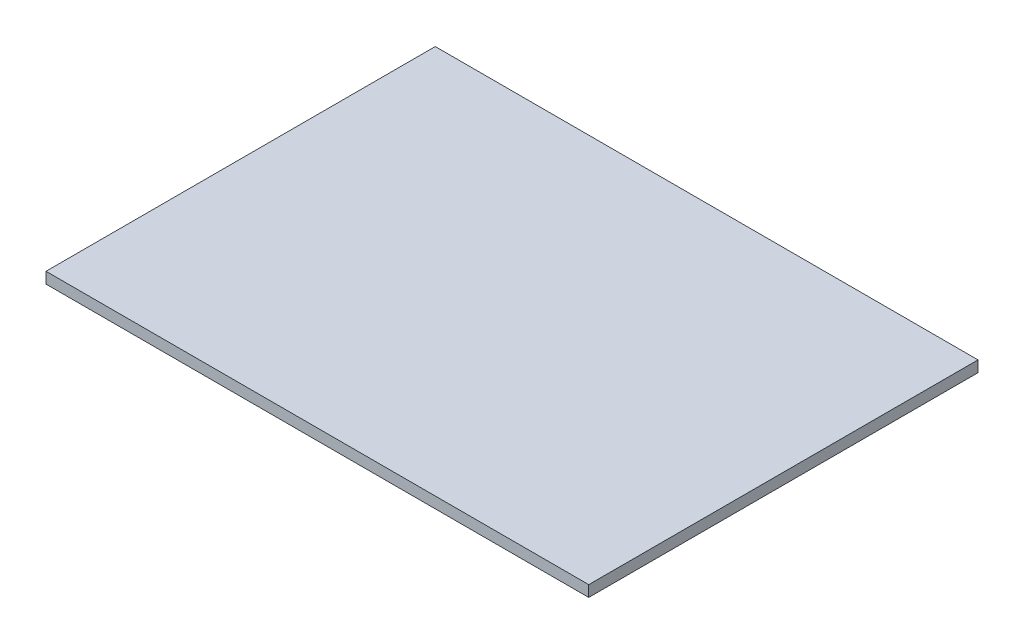
from build123d import *

# Parameters (mm, degrees)
SKETCH_1_W      = 244
SKETCH_1_H      = 175
EXTRUDE_1_DEPTH = 5


with BuildPart() as part:
    # 草图1 → 凸台-拉伸1 (new body)
    with BuildSketch(Plane(origin=(0, 0, 0), x_dir=(1, 0, 0), z_dir=(0, 1, 0))):
        with Locations((122, -87.5)):
            Rectangle(SKETCH_1_W, SKETCH_1_H)
    extrude(amount=EXTRUDE_1_DEPTH)


solid = part.part
